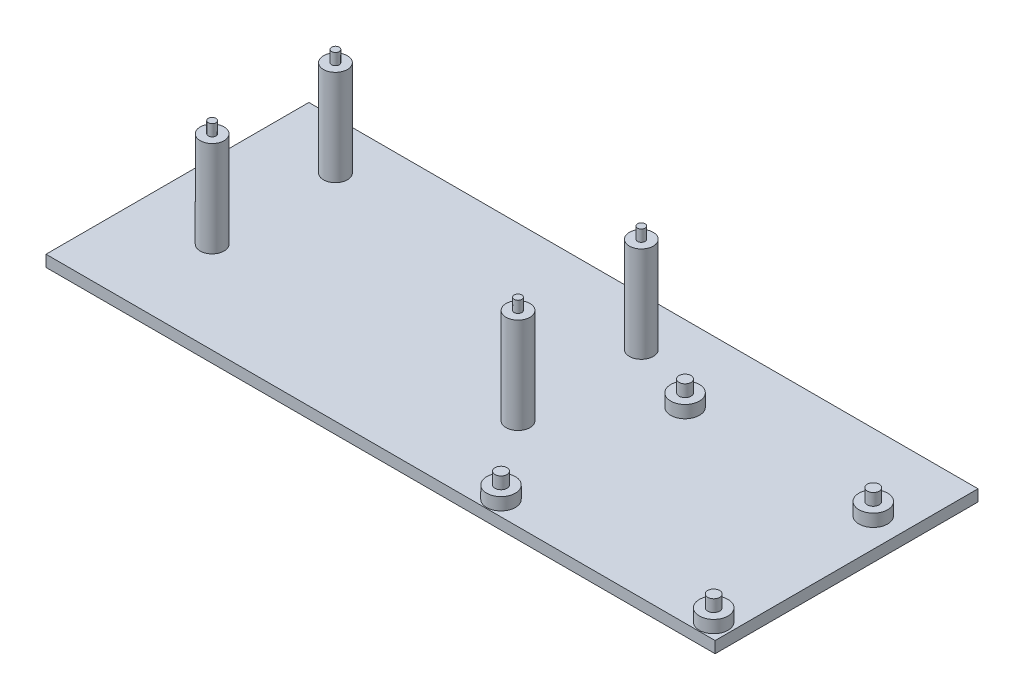
from build123d import *

# Parameters (mm, degrees)
SKETCH1_W           = 140
SKETCH1_H           = 55
BOSS_EXTRUDE1_DEPTH = 2.4
SKETCH2_R           = 3
BOSS_EXTRUDE2_DEPTH = 2.6
SKETCH3_R           = 1.25
BOSS_EXTRUDE3_DEPTH = 2.5
SKETCH4_R           = 2.5
BOSS_EXTRUDE4_DEPTH = 20
SKETCH5_R           = 0.8
BOSS_EXTRUDE5_DEPTH = 2.4


with BuildPart() as part:
    # Sketch1 → Boss-Extrude1 (new body)
    with BuildSketch(Plane(origin=(0, 0, 0), x_dir=(1, 0, 0), z_dir=(0, 1, 0))):
        Rectangle(SKETCH1_W, SKETCH1_H)
    extrude(amount=BOSS_EXTRUDE1_DEPTH)

    # Sketch2 → Boss-Extrude2 (add)
    with BuildSketch(Plane(origin=(0, 2.4, 0), x_dir=(1, 0, 0), z_dir=(0, 1, 0))):
        with Locations(Location((66.5, -24.3, 0), (0, 0, 90))):
            Circle(SKETCH2_R)
        with Locations(Location((63.94, 11.65, 0), (0, 0, 90))):
            Circle(SKETCH2_R)
        with Locations(Location((22, -24.3, 0), (0, 0, 90))):
            Circle(SKETCH2_R)
        with Locations(Location((24.56, 11.65, 0), (0, 0, 90))):
            Circle(SKETCH2_R)
    extrude(amount=BOSS_EXTRUDE2_DEPTH)

    # Sketch3 → Boss-Extrude3 (add)
    with BuildSketch(Plane(origin=(0, 5, 0), x_dir=(1, 0, 0), z_dir=(0, 1, 0))):
        with Locations(Location((22, -24.3, 0), (0, 0, 270))):
            Circle(SKETCH3_R)
        with Locations(Location((24.56, 11.65, 0), (0, 0, 270))):
            Circle(SKETCH3_R)
        with Locations(Location((66.5, -24.3, 0), (0, 0, 270))):
            Circle(SKETCH3_R)
        with Locations(Location((63.94, 11.65, 0), (0, 0, 270))):
            Circle(SKETCH3_R)
    extrude(amount=BOSS_EXTRUDE3_DEPTH)

    # Sketch4 → Boss-Extrude4 (add)
    with BuildSketch(Plane(origin=(0, 2.4, 0), x_dir=(1, 0, 0), z_dir=(0, 1, 0))):
        with Locations(Location((9.56, 17.5, 0), (0, 0, 90))):
            Circle(SKETCH4_R)
        with Locations(Location((-54.44, 17.5, 0), (0, 0, 90))):
            Circle(SKETCH4_R)
        with Locations(Location((-54.44, -8.3, 0), (0, 0, 90))):
            Circle(SKETCH4_R)
        with Locations(Location((9.56, -8.3, 0), (0, 0, 90))):
            Circle(SKETCH4_R)
    extrude(amount=BOSS_EXTRUDE4_DEPTH)

    # Sketch5 → Boss-Extrude5 (add)
    with BuildSketch(Plane(origin=(0, 22.4, 0), x_dir=(1, 0, 0), z_dir=(0, 1, 0))):
        with Locations(Location((9.56, -8.3, 0), (0, 0, 270))):
            Circle(SKETCH5_R)
        with Locations(Location((9.56, 17.5, 0), (0, 0, 270))):
            Circle(SKETCH5_R)
        with Locations(Location((-54.44, 17.5, 0), (0, 0, 270))):
            Circle(SKETCH5_R)
        with Locations(Location((-54.44, -8.3, 0), (0, 0, 270))):
            Circle(SKETCH5_R)
    extrude(amount=BOSS_EXTRUDE5_DEPTH)


solid = part.part
